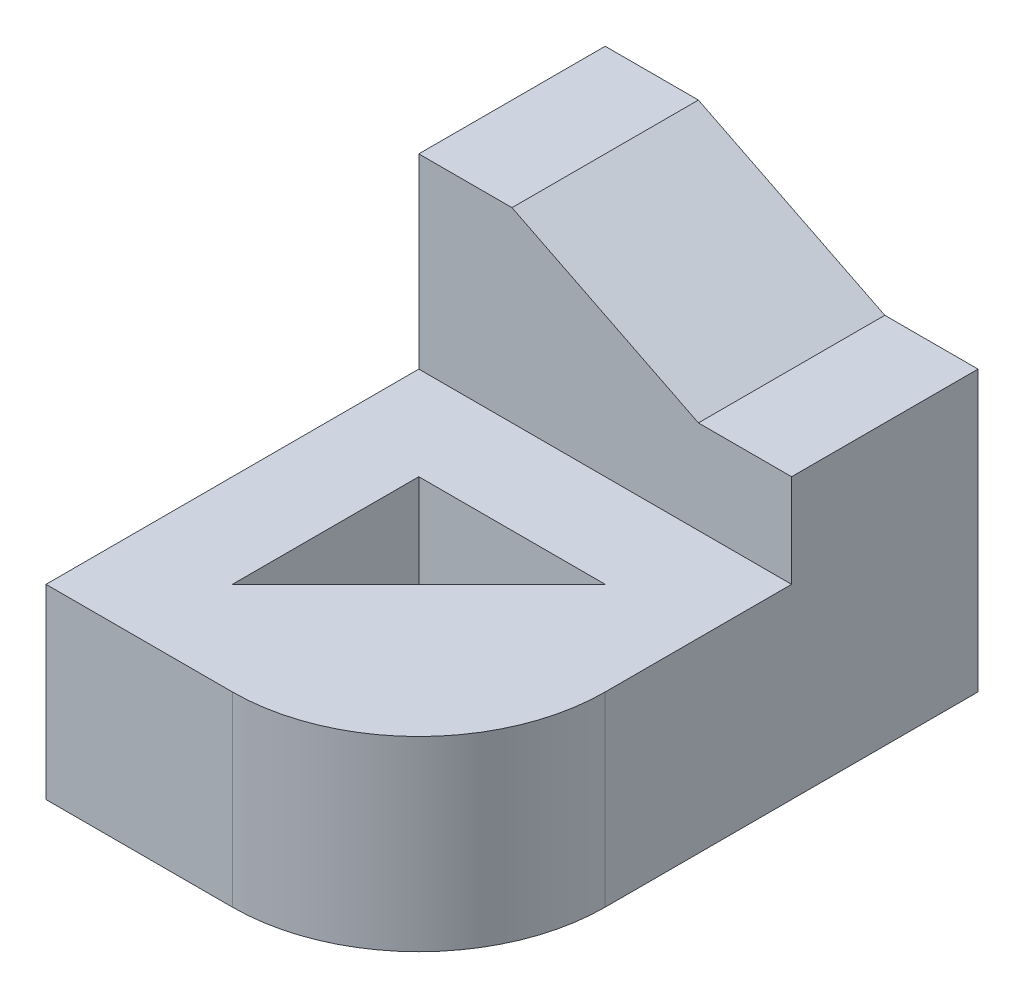
from build123d import *

# Parameters (mm, degrees)
SKETCH_1_W          = 20
SKETCH_1_H          = 30
EXTRUDE_1_DEPTH     = 10
FILLET_1_R          = 10
CUT_EXTRUDE_1_DEPTH = 38.416573868
EXTRUDE_2_DEPTH     = 10


with BuildPart() as part:
    # 草圖1 → 填料-伸長1 (new body)
    with BuildSketch(Plane(origin=(0, 0, 0), x_dir=(1, 0, 0), z_dir=(0, 1, 0))):
        with Locations((10, 15)):
            Rectangle(SKETCH_1_W, SKETCH_1_H)
    extrude(amount=EXTRUDE_1_DEPTH)

    # 圓角1
    fillet_1_edges = [part.edges().sort_by_distance(p)[0] for p in [
        (20, 5, 0),
    ]]
    fillet(fillet_1_edges, radius=FILLET_1_R)

    # 草圖2 → 除料-伸長1 (cut, through all)
    with BuildSketch(Plane(origin=(0, 10, 0), x_dir=(1, 0, 0), z_dir=(0, 1, 0))):
        Polygon((5, 15), (15, 15), (5, 5), align=None)
    extrude(amount=-CUT_EXTRUDE_1_DEPTH, mode=Mode.SUBTRACT)

    # 草圖3 → 填料-伸長2 (add)
    with BuildSketch(Plane(origin=(0, 0, -30), x_dir=(-1, 0, 0), z_dir=(0, 0, -1))):
        Polygon((0, 10), (0, 20), (-5, 20), (-15, 15), (-20, 15), (-20, 10), align=None)
    extrude(amount=-EXTRUDE_2_DEPTH)


solid = part.part
